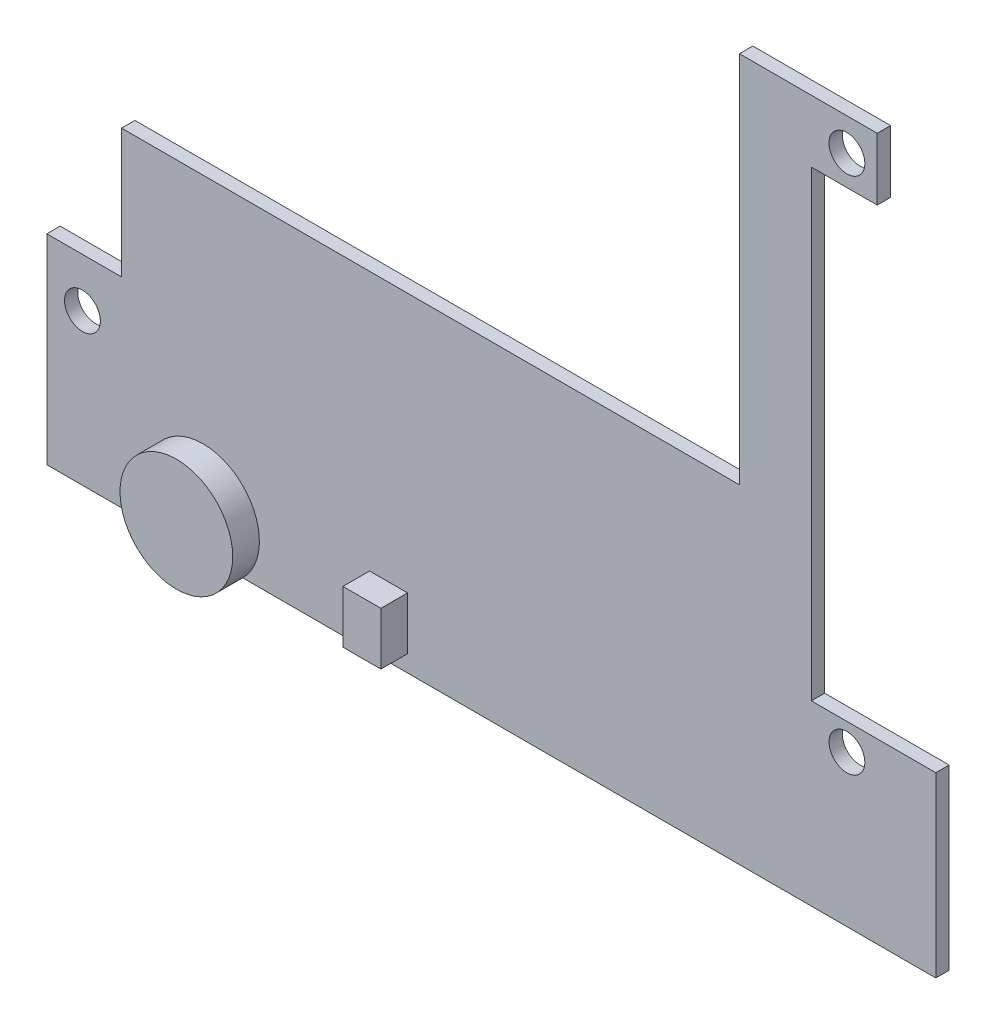
from build123d import *

# Parameters (mm, degrees)
SKETCH1_R           = 2.014647572
BOSS_EXTRUDE1_DEPTH = 1.5
SKETCH2_R           = 6.338534982
SKETCH2_W           = 4.270612397
SKETCH2_H           = 5.923752679
BOSS_EXTRUDE2_DEPTH = 3


with BuildPart() as part:
    # Sketch1 → Boss-Extrude1 (new body)
    with BuildSketch(Plane.XY):
        Polygon((6.096678716, 18.525469925), (6.096678716, 41.025469925), (14.504757975, 41.025469925), (14.504757975, 55.525469925), (84.004757975, 55.525469925), (84.004757975, 97.525469925), (99.504757975, 97.525469925), (99.504757975, 90.525469925), (92.096678716, 90.525469925), (92.096678716, 38.525469925), (106.096678716, 38.525469925), (106.096678716, 18.525469925), (70.532495119, 18.525469925), align=None)
        with Locations((96.096678716, 35.525469925)):
            Circle(SKETCH1_R, mode=Mode.SUBTRACT)
        with Locations((96.096678716, 93.874977547)):
            Circle(SKETCH1_R, mode=Mode.SUBTRACT)
        with Locations((10.096678716, 35.525469925)):
            Circle(SKETCH1_R, mode=Mode.SUBTRACT)
    extrude(amount=BOSS_EXTRUDE1_DEPTH)

    # Sketch2 → Boss-Extrude2 (add)
    with BuildSketch(Plane.XY.offset(1.5)):
        with Locations(Location((23.665238751, 23.02282619, 0), (0, 0, 225.19637393))):
            Circle(SKETCH2_R)
        with Locations((44.536134816, 23.367230416)):
            Rectangle(SKETCH2_W, SKETCH2_H)
    extrude(amount=BOSS_EXTRUDE2_DEPTH)


solid = part.part
